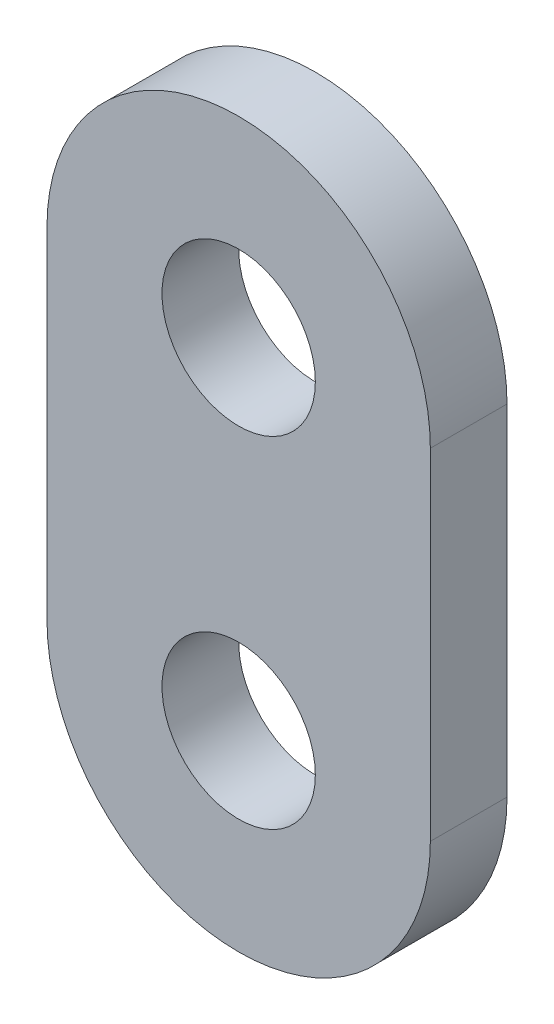
from build123d import *

# Parameters (mm, degrees)
CROQUIS1_R              = 10
SALIENTE_EXTRUIR1_DEPTH = 10


with BuildPart() as part:
    # Croquis1 → Saliente-Extruir1 (new body)
    with BuildSketch(Plane.XY):
        with BuildLine():
            Line((50, 0), (50, 44.4))
            ThreePointArc((50, 44.4), (25, 69.4), (0, 44.4))
            Line((0, 44.4), (0, 0))
            ThreePointArc((0, 0), (25, -25), (50, 0))
        make_face()
        with Locations((25, 44.4)):
            Circle(CROQUIS1_R, mode=Mode.SUBTRACT)
        with Locations((25, 0)):
            Circle(CROQUIS1_R, mode=Mode.SUBTRACT)
    extrude(amount=SALIENTE_EXTRUIR1_DEPTH)


solid = part.part
